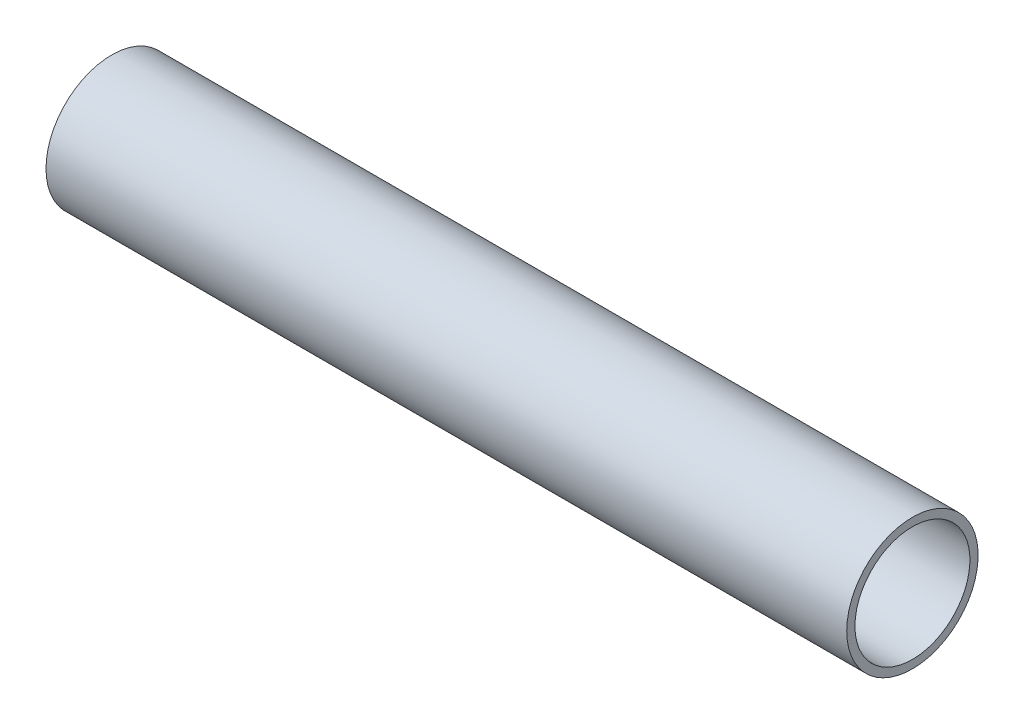
from build123d import *

# Parameters (mm, degrees)
ESQUISSE1_W = 195
ESQUISSE1_H = 2


with BuildPart() as part:
    # Esquisse1 → Révolution1 (revolve)
    with BuildSketch(Plane.XY, mode=Mode.PRIVATE) as r_volution1_sk:
        with Locations((22.6, 15)):
            Rectangle(ESQUISSE1_W, ESQUISSE1_H)
    revolve(r_volution1_sk.sketch.rotate(Axis((-82.95, 0, 0), (1, 0, 0)), 90), axis=Axis((-82.95, 0, 0), (1, 0, 0)))


solid = part.part
